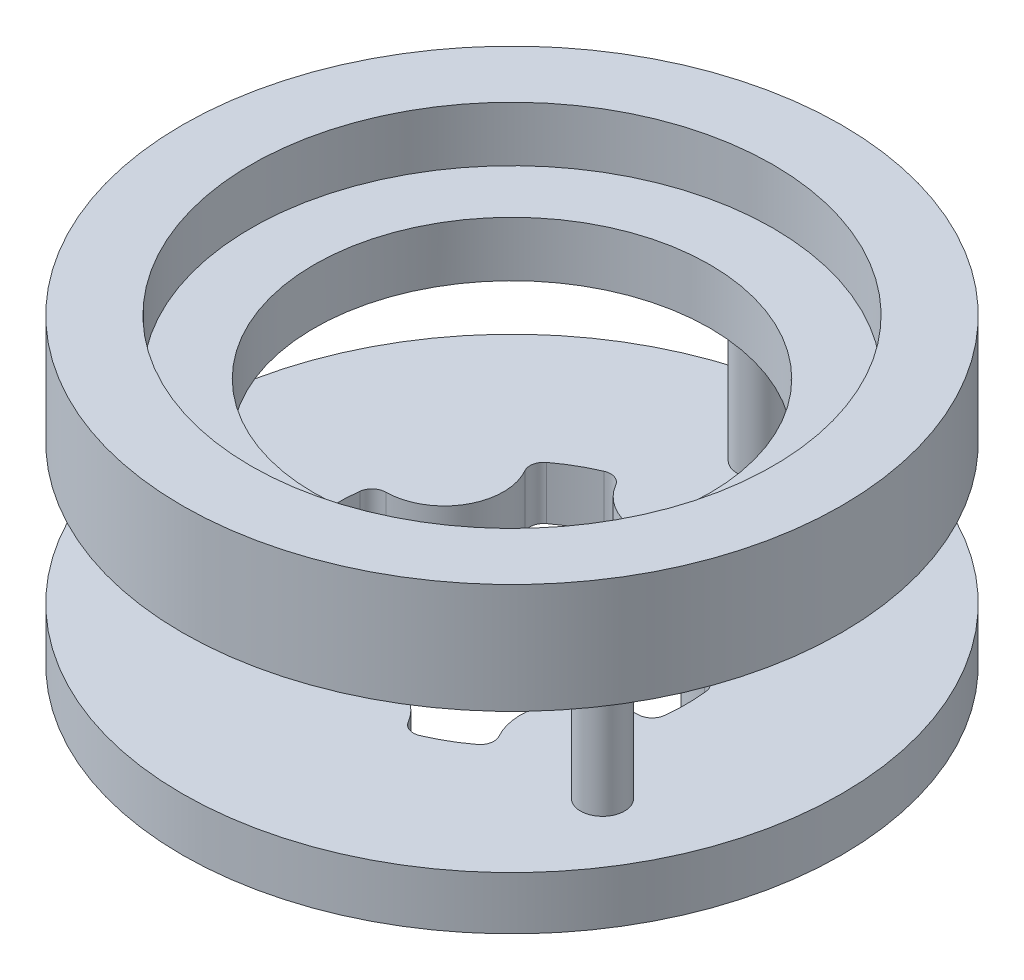
from build123d import *

# Parameters (mm, degrees)
SKETCH1_R           = 60
BOSS_EXTRUDE1_DEPTH = 9.652
SKETCH2_R           = 4
BOSS_EXTRUDE2_DEPTH = 25.4
SKETCH3_R           = 60
BOSS_EXTRUDE3_DEPTH = 20
SKETCH5_R           = 36
CUT_EXTRUDE1_DEPTH  = 92.807639682
SKETCH6_R           = 47.5
CUT_EXTRUDE2_DEPTH  = 10
FILLET1_R           = 2.54


with BuildPart() as part:
    # Sketch1 → Boss-Extrude1 (new body)
    with BuildSketch(Plane(origin=(0, 0, 0), x_dir=(1, 0, 0), z_dir=(0, 1, 0))):
        with Locations(Location((0, 0, 0), (0, 0, 270))):
            Circle(SKETCH1_R)
        with BuildLine():
            ThreePointArc((-10.16, 30.080506977), (0, 22.86), (10.16, 30.080506977))
            ThreePointArc((10.16, 30.080506977), (15.875, 27.49630657), (20.970483201, 23.839071591))
            ThreePointArc((20.970483201, 23.839071591), (19.797340731, 11.43), (31.130483201, 6.241435386))
            ThreePointArc((31.130483201, 6.241435386), (31.75, 0), (31.130483201, -6.241435386))
            ThreePointArc((31.130483201, -6.241435386), (19.797340731, -11.43), (20.970483201, -23.839071591))
            ThreePointArc((20.970483201, -23.839071591), (15.875, -27.49630657), (10.16, -30.080506977))
            ThreePointArc((10.16, -30.080506977), (0, -22.86), (-10.16, -30.080506977))
            ThreePointArc((-10.16, -30.080506977), (-15.875, -27.49630657), (-20.970483201, -23.839071591))
            ThreePointArc((-20.970483201, -23.839071591), (-19.797340731, -11.43), (-31.130483201, -6.241435386))
            ThreePointArc((-31.130483201, -6.241435386), (-31.75, 0), (-31.130483201, 6.241435386))
            ThreePointArc((-31.130483201, 6.241435386), (-19.797340731, 11.43), (-20.970483201, 23.839071591))
            ThreePointArc((-20.970483201, 23.839071591), (-15.875, 27.49630657), (-10.16, 30.080506977))
        make_face(mode=Mode.SUBTRACT)
    extrude(amount=BOSS_EXTRUDE1_DEPTH)

    # Sketch2 → Boss-Extrude2 (add)
    with BuildSketch(Plane(origin=(0, 9.652, 0), x_dir=(1, 0, 0), z_dir=(0, 1, 0))):
        with Locations(Location((0, 45, 0), (0, 0, 270))):
            Circle(SKETCH2_R)
        with Locations(Location((38.97114317, -22.5, 0), (0, 0, 270))):
            Circle(SKETCH2_R)
        with Locations(Location((-38.97114317, -22.5, 0), (0, 0, 270))):
            Circle(SKETCH2_R)
    extrude(amount=BOSS_EXTRUDE2_DEPTH)

    # Sketch3 → Boss-Extrude3 (add)
    with BuildSketch(Plane(origin=(0, 35.052, 0), x_dir=(1, 0, 0), z_dir=(0, 1, 0))):
        with Locations(Location((0, 0, 0), (0, 0, 270))):
            Circle(SKETCH3_R)
    extrude(amount=BOSS_EXTRUDE3_DEPTH)

    # Sketch5 → Cut-Extrude1 (cut, through all)
    with BuildSketch(Plane.XZ.offset(-35.052)):
        with Locations(Location((0, 0, 0), (0, 0, 270))):
            Circle(SKETCH5_R)
    extrude(amount=-CUT_EXTRUDE1_DEPTH, mode=Mode.SUBTRACT)

    # Sketch6 → Cut-Extrude2 (cut)
    with BuildSketch(Plane(origin=(0, 55.052, 0), x_dir=(1, 0, 0), z_dir=(0, 1, 0))):
        with Locations(Location((0, 0, 0), (0, 0, 270))):
            Circle(SKETCH6_R)
    extrude(amount=-CUT_EXTRUDE2_DEPTH, mode=Mode.SUBTRACT)

    # Fillet1
    fillet1_edges = [part.edges().sort_by_distance(p)[0] for p in [
        (-10.16, 4.826, 30.080506977),
        (10.16, 4.826, 30.080506977),
        (20.970483201, 4.826, 23.839071591),
        (31.130483201, 4.826, 6.241435386),
        (31.130483201, 4.826, -6.241435386),
        (20.970483201, 4.826, -23.839071591),
        (10.16, 4.826, -30.080506977),
        (-10.16, 4.826, -30.080506977),
        (-20.970483201, 4.826, -23.839071591),
        (-31.130483201, 4.826, -6.241435386),
        (-31.130483201, 4.826, 6.241435386),
        (-20.970483201, 4.826, 23.839071591),
    ]]
    fillet(fillet1_edges, radius=FILLET1_R)


solid = part.part
